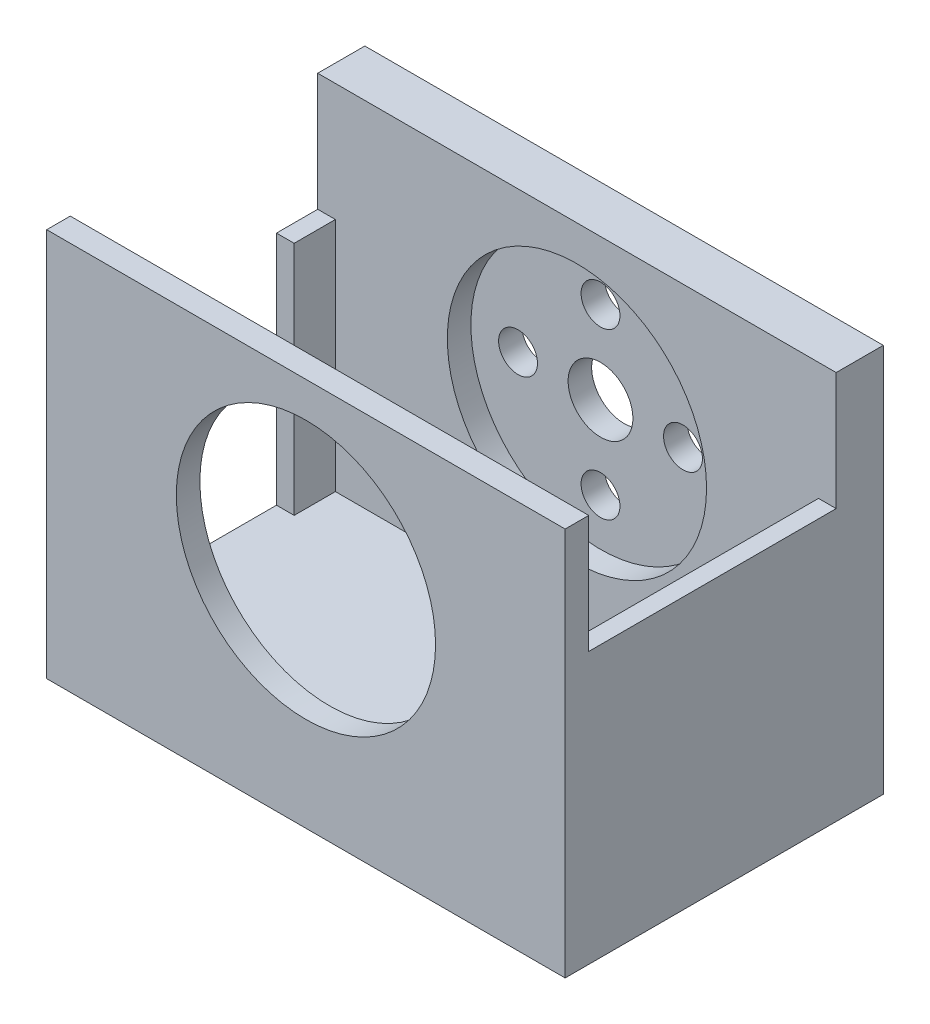
from build123d import *

# Parameters (mm, degrees)
SKETCH1_W               = 44
SKETCH1_H               = 27
BOSS_EXTRUDE1_DEPTH     = 23
CUT_EXTRUDE2_START      = 23
SKETCH2_W               = 41
SKETCH2_H               = 21
CUT_EXTRUDE2_DEPTH      = 20
CUT_EXTRUDE3_START      = -20.5
SKETCH3_W               = 14
SKETCH3_H               = 20
CUT_EXTRUDE3_DEPTH      = 20
BOSS_EXTRUDE2_START     = 23
SKETCH4_W               = 44
SKETCH4_H               = 4
SKETCH4_H_2             = 2
BOSS_EXTRUDE2_DEPTH     = 10
CUT_EXTRUDE4_DEPTH      = 42.895703837
CUT_EXTRUDE4_DEPTH_BACK = 2
CUT_EXTRUDE4_START      = -9.5
SKETCH5_R               = 11
CUT_EXTRUDE5_DEPTH      = 42.895703837
CUT_EXTRUDE5_DEPTH_BACK = 42.895703837
SKETCH6_R               = 1.65
SKETCH6_R_2             = 2.75


with BuildPart() as part:
    # Sketch1 → Boss-Extrude1 (new body)
    with BuildSketch(Plane(origin=(0, 0, 0), x_dir=(1, 0, 0), z_dir=(0, 1, 0))):
        Rectangle(SKETCH1_W, SKETCH1_H)
    extrude(amount=BOSS_EXTRUDE1_DEPTH)

    # Sketch2 → Cut-Extrude2 (cut)
    with BuildSketch(Plane(origin=(0, 0, 0), x_dir=(1, 0, 0), z_dir=(0, 1, 0)).offset(CUT_EXTRUDE2_START)):
        with Locations((0, -1)):
            Rectangle(SKETCH2_W, SKETCH2_H)
    extrude(amount=-CUT_EXTRUDE2_DEPTH, mode=Mode.SUBTRACT)

    # Sketch3 → Cut-Extrude3 (cut)
    with BuildSketch(Plane(origin=(0, 0, 0), x_dir=(0, 0, -1), z_dir=(1, 0, 0)).offset(CUT_EXTRUDE3_START)):
        with Locations((-1, 13)):
            Rectangle(SKETCH3_W, SKETCH3_H)
    extrude(amount=-CUT_EXTRUDE3_DEPTH, mode=Mode.SUBTRACT)

    # Sketch4 → Boss-Extrude2 (add)
    with BuildSketch(Plane(origin=(0, 0, 0), x_dir=(1, 0, 0), z_dir=(0, 1, 0)).offset(BOSS_EXTRUDE2_START)):
        with Locations((0, 11.5)):
            Rectangle(SKETCH4_W, SKETCH4_H)
        with Locations((0, -12.5)):
            Rectangle(SKETCH4_W, SKETCH4_H_2)
    extrude(amount=BOSS_EXTRUDE2_DEPTH)

    # Sketch5 → Cut-Extrude4 (cut, two sides: drawn at the far end of the back side and taken through both)
    with BuildSketch(Plane.XY.offset(CUT_EXTRUDE4_START - CUT_EXTRUDE4_DEPTH_BACK)):
        with Locations((0, 19)):
            Circle(SKETCH5_R)
    extrude(amount=CUT_EXTRUDE4_DEPTH + CUT_EXTRUDE4_DEPTH_BACK, mode=Mode.SUBTRACT)

    # Sketch6 → Cut-Extrude5 (cut, two sides: drawn at the far end of the back side and taken through both)
    with BuildSketch(Plane.XY.offset(-CUT_EXTRUDE5_DEPTH_BACK)):
        with Locations((-7, 19)):
            Circle(SKETCH6_R)
        with Locations((0, 19)):
            Circle(SKETCH6_R_2)
        with Locations((0, 26)):
            Circle(SKETCH6_R)
        with Locations((7, 19)):
            Circle(SKETCH6_R)
        with Locations((0, 12)):
            Circle(SKETCH6_R)
    extrude(amount=CUT_EXTRUDE5_DEPTH + CUT_EXTRUDE5_DEPTH_BACK, mode=Mode.SUBTRACT)


solid = part.part
